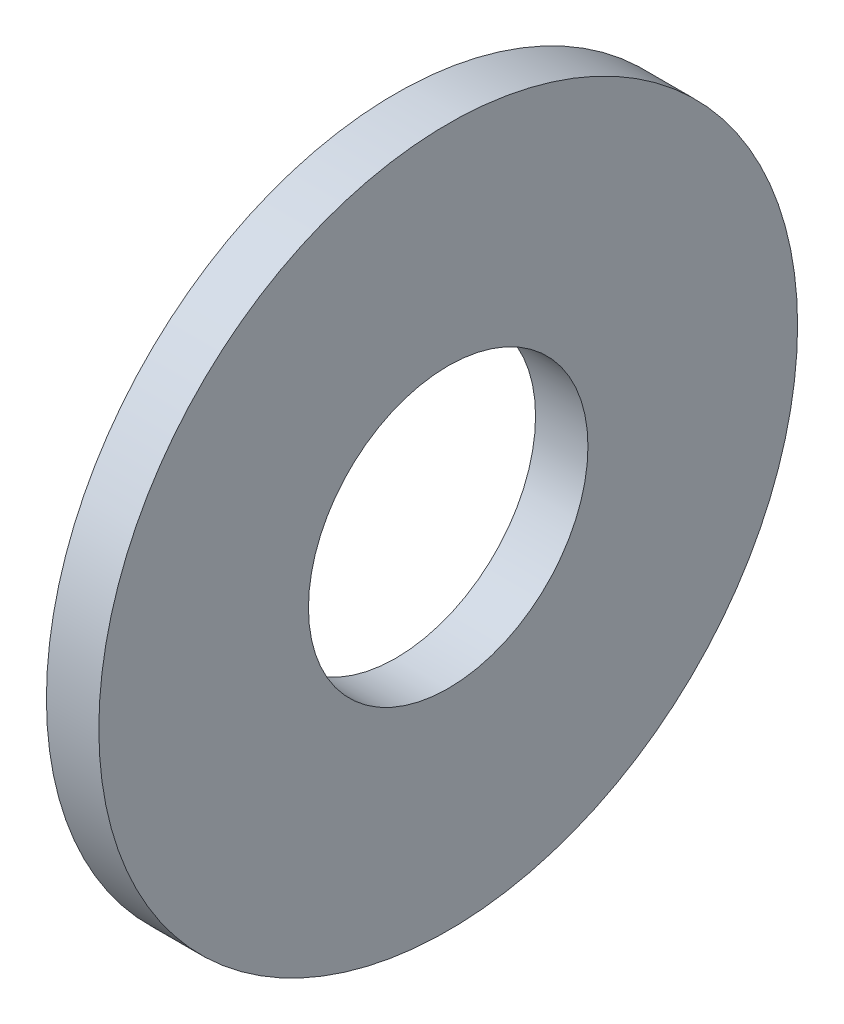
from build123d import *

# Parameters (mm, degrees)
SKETCH2_R           = 2
SKETCH2_R_2         = 0.8
BOSS_EXTRUDE1_DEPTH = 0.3


with BuildPart() as part:
    # Sketch2 → Boss-Extrude1 (new body)
    with BuildSketch(Plane(origin=(0, 0, 0), x_dir=(0, 0, -1), z_dir=(1, 0, 0))):
        Circle(SKETCH2_R)
        Circle(SKETCH2_R_2, mode=Mode.SUBTRACT)
    extrude(amount=BOSS_EXTRUDE1_DEPTH)


solid = part.part
